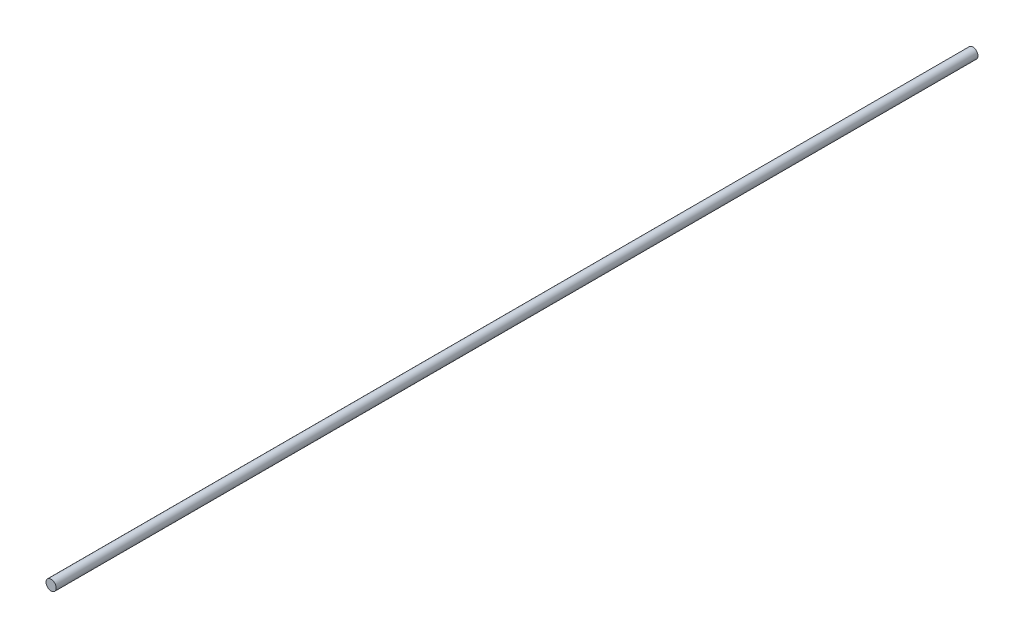
from build123d import *

# Parameters (mm, degrees)
SKETCH1_R           = 4
BOSS_EXTRUDE1_DEPTH = 721


with BuildPart() as part:
    # Sketch1 → Boss-Extrude1 (new body)
    with BuildSketch(Plane.XY):
        Circle(SKETCH1_R)
    extrude(amount=BOSS_EXTRUDE1_DEPTH)


solid = part.part
